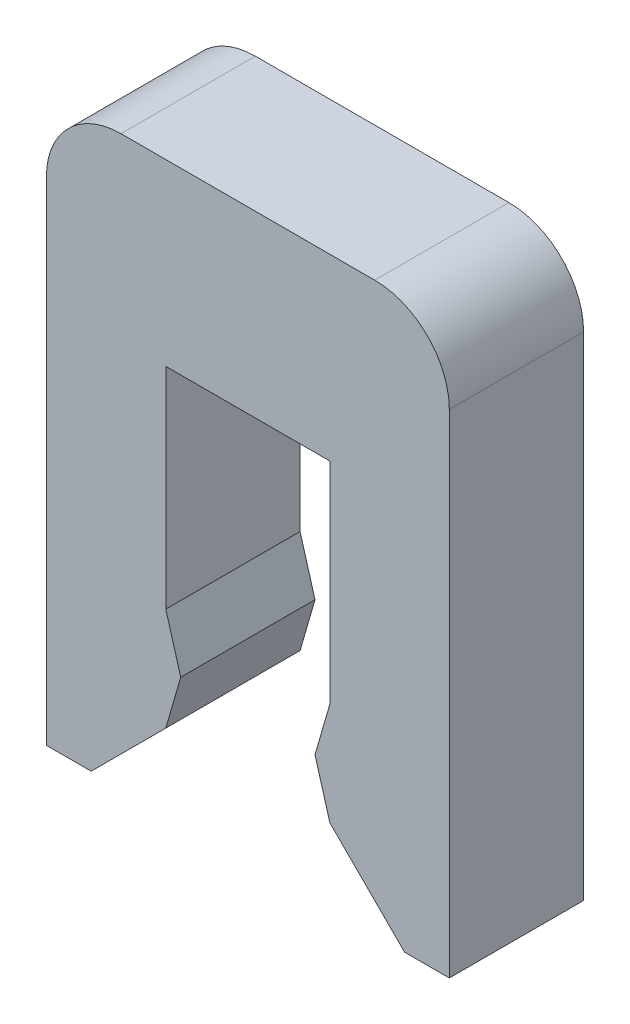
from build123d import *

# Parameters (mm, degrees)
EXTRUDE_1_DEPTH = 0.9
CHAMFER_1_SIZE  = 0.5
FILLET_1_R      = 0.5
EXTRUDE_2_DEPTH = 0.9


with BuildPart() as part:
    # Эскиз1 → Бобышка-Вытянуть1 (new body)
    with BuildSketch(Plane.XY):
        Polygon((-0.55, 0), (0.55, 0), (0.55, -2.6), (1.35, -2.6), (1.35, 1.2), (-1.35, 1.2), (-1.35, -2.6), (-0.55, -2.6), align=None)
    extrude(amount=EXTRUDE_1_DEPTH)

    # Фаска1
    chamfer_1_edges = [part.edges().sort_by_distance(p)[0] for p in [
        (-0.55, -2.6, 0.45),
        (0.55, -2.6, 0.45),
    ]]
    chamfer(chamfer_1_edges, length=CHAMFER_1_SIZE)

    # Скругление1
    fillet_1_edges = [part.edges().sort_by_distance(p)[0] for p in [
        (-1.35, 1.2, 0.45),
        (1.35, 1.2, 0.45),
    ]]
    fillet(fillet_1_edges, radius=FILLET_1_R)

    # Эскиз2 → Бобышка-Вытянуть2 (add)
    with BuildSketch(Plane.XY.offset(0.9)):
        Polygon((-0.55, -2.1), (-0.55, -1.409040923), (-0.45, -1.754520462), align=None)
    extrude_2 = extrude(amount=-EXTRUDE_2_DEPTH)

    # Зеркальное отражение1: Бобышка-Вытянуть2 across plane
    add(extrude_2.mirror(Plane(origin=(0, 0, 0), x_dir=(0, 0, 1), z_dir=(1, 0, 0))))


solid = part.part
